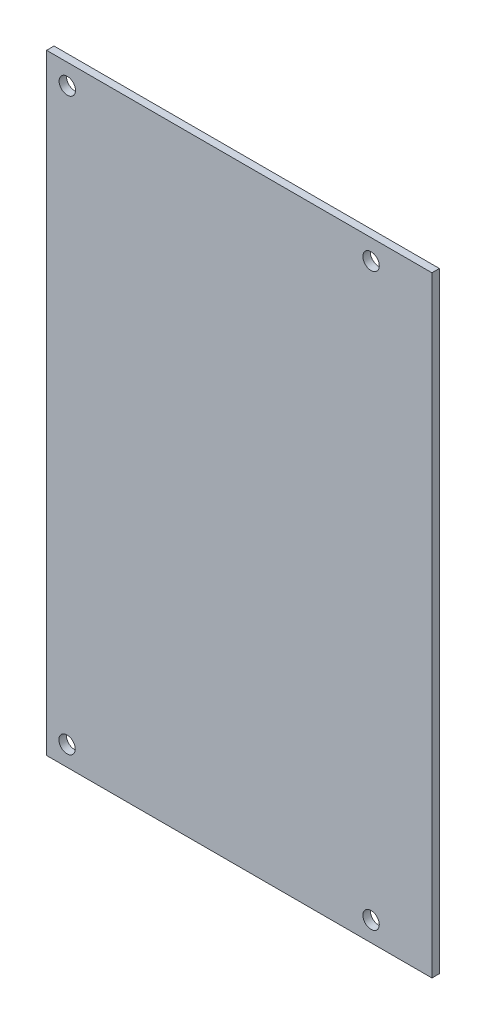
from build123d import *

# Parameters (mm, degrees)
MODEL_R             = 1.65
BOSS_EXTRUDE1_DEPTH = 1.5


with BuildPart() as part:
    # Model → Boss-Extrude1 (new body)
    with BuildSketch(Plane.XY):
        Polygon((90.5002, 123.101), (90.5002, 123.038), (90.5002, 0.0508), (90.5002, 0), (12.827, 0), (12.827, 123.101), align=None)
        with Locations((17.0002, 118.999)):
            Circle(MODEL_R, mode=Mode.SUBTRACT)
        with Locations((16.9545, 4.0005)):
            Circle(MODEL_R, mode=Mode.SUBTRACT)
        with Locations((78.232, 3.999)):
            Circle(MODEL_R, mode=Mode.SUBTRACT)
        with Locations((78.232, 118.999)):
            Circle(MODEL_R, mode=Mode.SUBTRACT)
    extrude(amount=BOSS_EXTRUDE1_DEPTH)


solid = part.part
